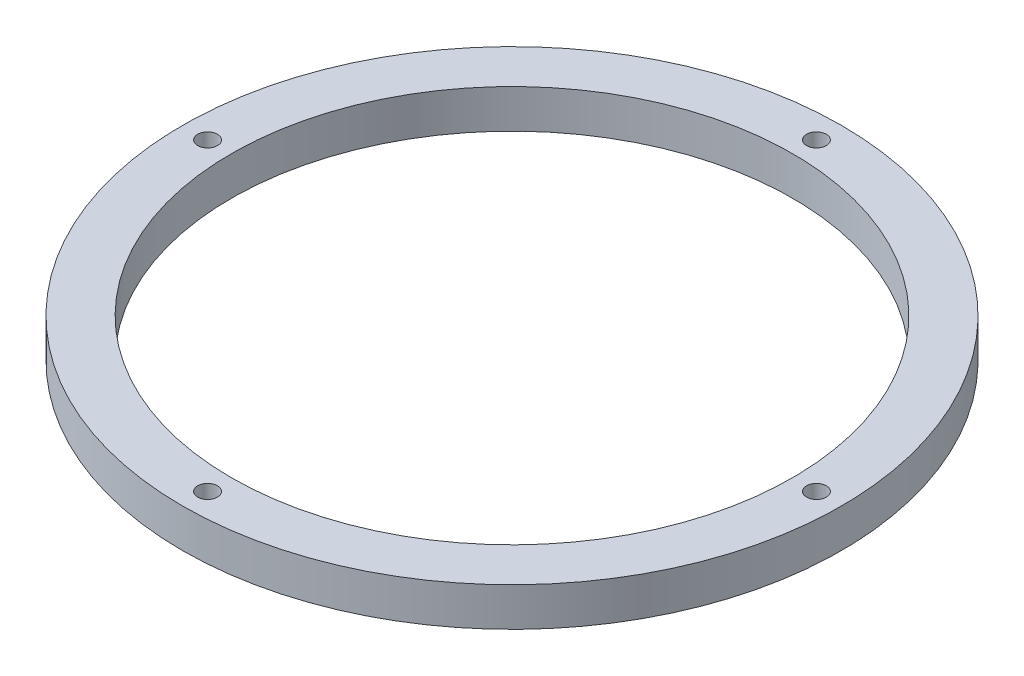
from build123d import *

# Parameters (mm, degrees)
SKETCH1_R                                          = 85.250000061
SKETCH1_R_2                                        = 72.599999961
BOSS_EXTRUDE1_DEPTH                                = 5.000000033
SKETCH2_R                                          = 1.27
CUT_EXTRUDE1_DEPTH                                 = 121.665343082
CIRPATTERN1_COUNT                                  = 4
CSK_FOR_10_FLAT_HEAD_MACHINE_SCREW_100_D           = 5.1054
CSK_FOR_10_FLAT_HEAD_MACHINE_SCREW_100_CSINK_D     = 9.779
CSK_FOR_10_FLAT_HEAD_MACHINE_SCREW_100_CSINK_ANGLE = 100


with BuildPart() as part:
    # Sketch1 → Boss-Extrude1 (new, symmetric)
    with BuildSketch(Plane(origin=(0, 0, 0), x_dir=(1, 0, 0), z_dir=(0, 1, 0))):
        Circle(SKETCH1_R)
        Circle(SKETCH1_R_2, mode=Mode.SUBTRACT)
    extrude(amount=BOSS_EXTRUDE1_DEPTH, both=True)

    # Sketch2 → Cut-Extrude1 (cut, symmetric)
    with BuildSketch(Plane(origin=(0, 0, 0), x_dir=(1, 0, 0), z_dir=(0, 1, 0))):
        with Locations((-78.74999998, 0)):
            Circle(SKETCH2_R)
    cut_extrude1 = extrude(amount=CUT_EXTRUDE1_DEPTH, both=True, mode=Mode.SUBTRACT)

    # CirPattern1: Cut-Extrude1 ×4 about axis
    cirpattern1_axis = Axis((0, 5.500000036, 0), (0, -1, 0))
    for i in range(1, CIRPATTERN1_COUNT):
        add(cut_extrude1.rotate(cirpattern1_axis, i * 360 / CIRPATTERN1_COUNT), mode=Mode.SUBTRACT)

    # CSK for #10 Flat Head Machine Screw (100)1 (through all)
    with Locations(Plane(origin=(78.74999998, -5.000000033, 0), x_dir=(0, 0, -1), z_dir=(0, -1, 0))):
        with Locations((0, 0), (78.74999998, -78.74999998), (0, -157.49999996), (-78.74999998, -78.74999998)):
            CounterSinkHole(CSK_FOR_10_FLAT_HEAD_MACHINE_SCREW_100_D / 2, CSK_FOR_10_FLAT_HEAD_MACHINE_SCREW_100_CSINK_D / 2, counter_sink_angle=CSK_FOR_10_FLAT_HEAD_MACHINE_SCREW_100_CSINK_ANGLE)


solid = part.part
